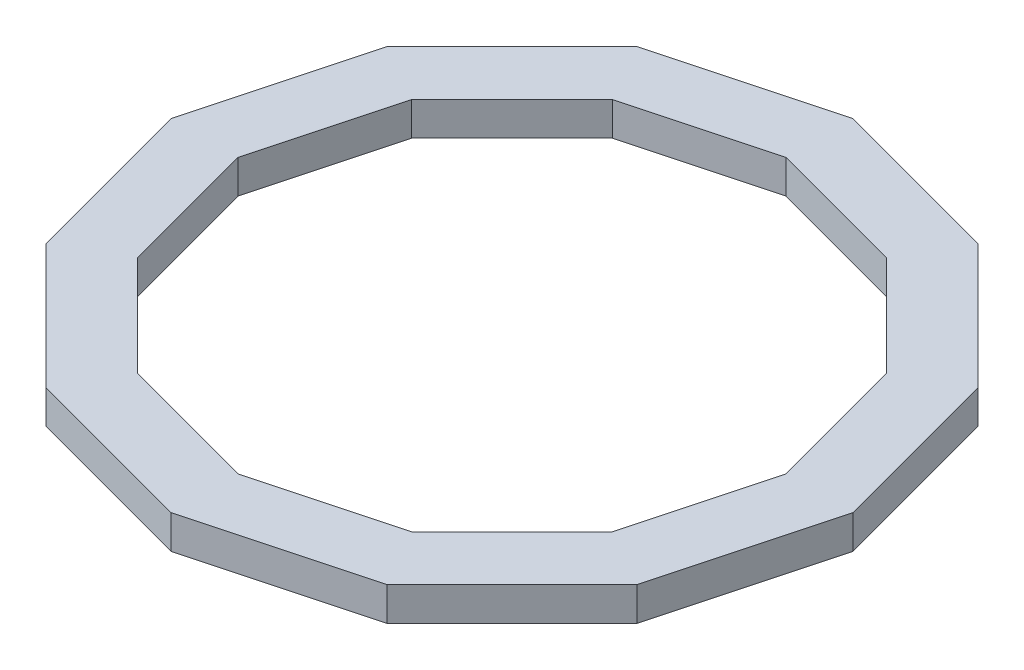
from build123d import *

# Parameters (mm, degrees)
BOSS_EXTRUDE2_DEPTH = 19.05


with BuildPart() as part:
    # Sketch2 → Boss-Extrude2 (new body)
    with BuildSketch(Plane(origin=(0, 0, 0), x_dir=(1, 0, 0), z_dir=(0, 1, 0))):
        Polygon((-193.822676303, 0), (-167.855361508, -96.911338152), (-96.911338152, -167.855361508), (0, -193.822676303), (96.911338152, -167.855361508), (167.855361508, -96.911338152), (193.822676303, 0), (167.855361508, 96.911338152), (96.911338152, 167.855361508), (0, 193.822676303), (-96.911338152, 167.855361508), (-167.855361508, 96.911338152), align=None)
        Polygon((-155.693454579, 0), (-134.834486868, -77.846727289), (-77.846727289, -134.834486868), (0, -155.693454579), (77.846727289, -134.834486868), (134.834486868, -77.846727289), (155.693454579, 0), (134.834486868, 77.846727289), (77.846727289, 134.834486868), (0, 155.693454579), (-77.846727289, 134.834486868), (-134.834486868, 77.846727289), align=None, mode=Mode.SUBTRACT)
    extrude(amount=BOSS_EXTRUDE2_DEPTH)


solid = part.part
